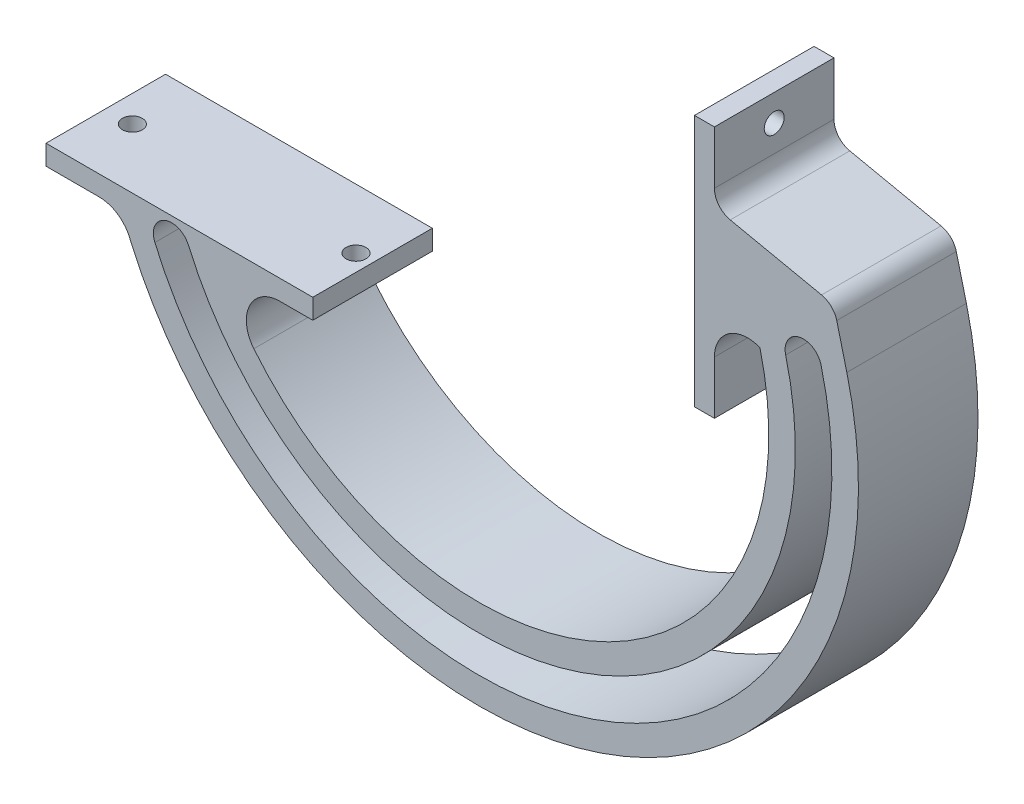
from build123d import *

# Parameters (mm, degrees)
SALIENTE_EXTRUIR2_DEPTH     = 9
SALIENTE_EXTRUIR4_START     = -18
SALIENTE_EXTRUIR4_DEPTH     = 18
CORTAR_EXTRUIR3_DEPTH       = 81.972689334
CORTAR_EXTRUIR3_DEPTH_BACK  = 81.972689334
CROQUIS8_W                  = 8.024298647
CROQUIS8_H                  = 2.298422897
SALIENTE_EXTRUIR5_START     = -18
SALIENTE_EXTRUIR5_DEPTH     = 18
SALIENTE_EXTRUIR6_DEPTH     = 18
SALIENTE_EXTRUIR7_START     = -18
SALIENTE_EXTRUIR7_DEPTH     = 18
CORTAR_EXTRUIR5_DEPTH       = 118.18938142
CORTAR_EXTRUIR5_DEPTH_BACK  = 118.18938142
CROQUIS13_R                 = 1.5
CROQUIS14_R                 = 1.5
CORTAR_EXTRUIR7_DEPTH       = 4
CROQUIS15_R                 = 1.5
CORTAR_EXTRUIR8_DEPTH       = 97.711059211
CROQUIS16_R                 = 1.5
CORTAR_EXTRUIR9_DEPTH       = 97.711059211
CORTAR_EXTRUIR10_DEPTH      = 101.245514063
CORTAR_EXTRUIR10_DEPTH_BACK = 101.245514063
CROQUIS17_W                 = 15.073627069
CROQUIS17_H                 = 8.059357869


with BuildPart() as part:
    # Croquis1 → Saliente-Extruir2 (new, symmetric)
    with BuildSketch(Plane.XY):
        with BuildLine():
            ThreePointArc((-66.012618404, 0.60672559), (4.861867519, -30.780766865), (41.832299444, 37.348188804))
            ThreePointArc((41.832299444, 37.348188804), (33.631578066, 42.234206494), (28.745560376, 34.033485116))
            ThreePointArc((28.745560376, 34.033485116), (0.508301336, -18.002016476), (-53.624180056, 5.97110769))
            ThreePointArc((-53.624180056, 5.97110769), (-62.50059028, 9.483135814), (-66.012618404, 0.60672559))
        make_face()
        with BuildLine():
            ThreePointArc((37.954747128, 36.366054378), (34.613712492, 38.356654178), (32.623112692, 35.015619542))
            ThreePointArc((32.623112692, 35.015619542), (1.798246872, -21.788312888), (-57.294828456, 4.381661142))
            ThreePointArc((-57.294828456, 4.381661142), (-60.911143732, 5.812487414), (-62.341970004, 2.196172138))
            ThreePointArc((-62.341970004, 2.196172138), (3.571921983, -26.994470453), (37.954747128, 36.366054378))
        make_face(mode=Mode.SUBTRACT)
    extrude(amount=SALIENTE_EXTRUIR2_DEPTH, both=True)

    # Croquis7 → Saliente-Extruir4 (add)
    with BuildSketch(Plane(origin=(0, 0, -9), x_dir=(-1, 0, 0), z_dir=(0, 0, -1)).offset(SALIENTE_EXTRUIR4_START)):
        with BuildLine():
            Line((54.145016493, 6.946132565), (38.567143253, 6.946132565))
            Line((38.567143253, 6.946132565), (38.567143253, 3.946132565))
            Line((38.567143253, 3.946132565), (43.567143253, 3.946132565))
            ThreePointArc((43.567143253, 3.946132565), (48.081738335, 1.095186137), (47.447985926, -4.206494934))
            ThreePointArc((47.447985926, -4.206494934), (50.884688207, 0.670758181), (53.624180056, 5.97110769))
            ThreePointArc((53.624180056, 5.97110769), (53.864605301, 6.469299926), (54.145016493, 6.946132565))
        make_face()
    extrude(amount=SALIENTE_EXTRUIR4_DEPTH)

    # Croquis8 → Cortar-Extruir3 (cut, two sides: drawn at the far end of the back side and taken through both)
    with BuildSketch(Plane(origin=(0, 0, -9), x_dir=(-1, 0, 0), z_dir=(0, 0, -1)).offset(-CORTAR_EXTRUIR3_DEPTH_BACK)):
        with Locations((58.157165816, 8.095344014)):
            Rectangle(CROQUIS8_W, CROQUIS8_H)
    extrude(amount=CORTAR_EXTRUIR3_DEPTH + CORTAR_EXTRUIR3_DEPTH_BACK, mode=Mode.SUBTRACT)

    # Croquis9 → Saliente-Extruir5 (add)
    with BuildSketch(Plane(origin=(0, 0, -9), x_dir=(-1, 0, 0), z_dir=(0, 0, -1)).offset(SALIENTE_EXTRUIR5_START)):
        with BuildLine():
            Line((78.728806569, 3.946132565), (78.728806569, 6.946132565))
            Line((78.728806569, 6.946132565), (65.491781967, 6.946132565))
            ThreePointArc((65.491781967, 6.946132565), (66.526259445, 4.041984592), (66.161494713, 0.980748601))
            ThreePointArc((66.161494713, 0.980748601), (68.00603961, 3.139763461), (70.728806569, 3.946132565))
            Line((70.728806569, 3.946132565), (78.728806569, 3.946132565))
        make_face()
    extrude(amount=SALIENTE_EXTRUIR5_DEPTH)

    # Croquis10 → Saliente-Extruir6 (add)
    with BuildSketch(Plane.XY.offset(9)):
        with BuildLine():
            Line((18.89630467, 56.388029989), (18.89630467, 21.388029989))
            Line((18.89630467, 21.388029989), (21.89630467, 21.388029989))
            Line((21.89630467, 21.388029989), (21.89630467, 29.388029989))
            ThreePointArc((21.89630467, 29.388029989), (24.089730114, 33.5260415), (28.745560376, 34.033485116))
            ThreePointArc((28.745560376, 34.033485116), (30.517183559, 40.465031841), (36.949638278, 42.233355414))
            Line((36.949638278, 42.233355414), (24.158212062, 45.48024401))
            ThreePointArc((24.158212062, 45.48024401), (22.528364866, 46.546057924), (21.89630467, 48.388029989))
            Line((21.89630467, 48.388029989), (21.89630467, 56.388029989))
            Line((21.89630467, 56.388029989), (18.89630467, 56.388029989))
        make_face()
    extrude(amount=-SALIENTE_EXTRUIR6_DEPTH)

    # Croquis12 → Saliente-Extruir7 (add)
    with BuildSketch(Plane(origin=(0, 0, -9), x_dir=(-1, 0, 0), z_dir=(0, 0, -1)).offset(SALIENTE_EXTRUIR7_START)):
        with BuildLine():
            Line((-41.832299444, 37.348188804), (-40.312576156, 43.348188804))
            ThreePointArc((-40.312576156, 43.348188804), (-39.483140086, 44.774662002), (-38.02482177, 45.546735616))
            Line((-38.02482177, 45.546735616), (-24.275894818, 48.452882358))
            ThreePointArc((-24.275894818, 48.452882358), (-22.565936721, 49.49874832), (-21.89630467, 51.388029989))
            Line((-21.89630467, 51.388029989), (-21.89630467, 59.388029989))
            Line((-21.89630467, 59.388029989), (-18.89630467, 59.388029989))
            Line((-18.89630467, 59.388029989), (-18.89630467, 21.388029989))
            Line((-18.89630467, 21.388029989), (-21.89630467, 21.388029989))
            Line((-21.89630467, 21.388029989), (-21.89630467, 29.388029989))
            ThreePointArc((-21.89630467, 29.388029989), (-24.089730114, 33.5260415), (-28.745560376, 34.033485116))
            Line((-28.745560376, 34.033485116), (-32.623112692, 35.015619542))
            ThreePointArc((-32.623112692, 35.015619542), (-34.613712492, 38.356654178), (-37.954747128, 36.366054378))
            Line((-37.954747128, 36.366054378), (-41.832299444, 37.348188804))
        make_face()
    extrude(amount=SALIENTE_EXTRUIR7_DEPTH)

    # Croquis13 → Cortar-Extruir5 (cut, two sides: drawn at the far end of the back side and taken through both)
    with BuildSketch(Plane(origin=(21.89630467, 0, 0), x_dir=(0, 0, -1), z_dir=(1, 0, 0)).offset(-CORTAR_EXTRUIR5_DEPTH_BACK)):
        with Locations(Location((0, 55.388029989, 0), (0, 0, 90))):
            Circle(CROQUIS13_R)
    extrude(amount=CORTAR_EXTRUIR5_DEPTH + CORTAR_EXTRUIR5_DEPTH_BACK, mode=Mode.SUBTRACT)

    # Croquis14 → Cortar-Extruir7 (cut, symmetric)
    with BuildSketch(Plane(origin=(21.89630467, 0, 0), x_dir=(0, 0, -1), z_dir=(1, 0, 0))):
        with Locations((0, 25.388029989)):
            Circle(CROQUIS14_R)
    extrude(amount=CORTAR_EXTRUIR7_DEPTH, both=True, mode=Mode.SUBTRACT)

    # Croquis15 → Cortar-Extruir8 (cut, through all)
    with BuildSketch(Plane.XZ.offset(-3.946132565)):
        with Locations((-74.728806569, 0)):
            Circle(CROQUIS15_R)
    extrude(amount=-CORTAR_EXTRUIR8_DEPTH, mode=Mode.SUBTRACT)

    # Croquis16 → Cortar-Extruir9 (cut, through all)
    with BuildSketch(Plane.XZ.offset(-3.946132565)):
        with Locations(Location((-41.067143253, 0, 0), (0, 0, 270))):
            Circle(CROQUIS16_R)
    extrude(amount=-CORTAR_EXTRUIR9_DEPTH, mode=Mode.SUBTRACT)

    # Croquis17 → Cortar-Extruir10 (cut, two sides: drawn at the far end of the back side and taken through both)
    with BuildSketch(Plane.XY.offset(9).offset(-CORTAR_EXTRUIR10_DEPTH_BACK)):
        with Locations((-57.954968433, 10.9758115)):
            Rectangle(CROQUIS17_W, CROQUIS17_H)
    extrude(amount=CORTAR_EXTRUIR10_DEPTH + CORTAR_EXTRUIR10_DEPTH_BACK, mode=Mode.SUBTRACT)


solid = part.part
